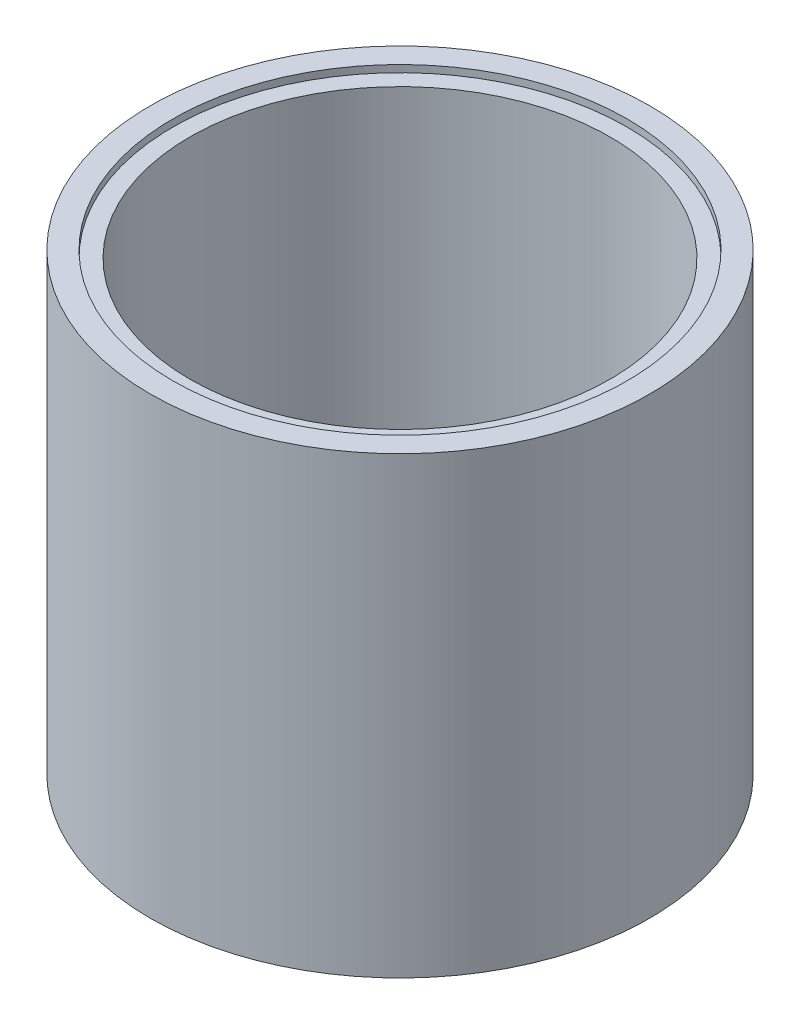
from build123d import *

# Parameters (mm, degrees)
SKETCH1_R                    = 55.88
SKETCH1_R_2                  = 46.99
BOSS_EXTRUDE4_DEPTH          = 101.6
SKETCH3_R                    = 50.8
CUT_EXTRUDE3_DEPTH           = 1.5875
F_1_4_28_TAPPED_HOLE1_REACH  = 156.393
F_1_4_28_TAPPED_HOLE1_BORE_R = 2.7051


with BuildPart() as part:
    # Sketch1 → Boss-Extrude4 (new body)
    with BuildSketch(Plane(origin=(0, 0, 0), x_dir=(1, 0, 0), z_dir=(0, 1, 0))):
        with Locations(Location((0, 0, 0), (0, 0, 270))):
            Circle(SKETCH1_R)
        with Locations(Location((0, 0, 0), (0, 0, 270))):
            Circle(SKETCH1_R_2, mode=Mode.SUBTRACT)
    extrude(amount=-BOSS_EXTRUDE4_DEPTH)

    # Sketch3 → Cut-Extrude3 (cut)
    with BuildSketch(Plane(origin=(0, 0, 0), x_dir=(1, 0, 0), z_dir=(0, 1, 0))):
        with Locations(Location((0, 0, 0), (0, 0, 270))):
            Circle(SKETCH3_R)
    extrude(amount=-CUT_EXTRUDE3_DEPTH, mode=Mode.SUBTRACT)

    # 1/4-28 Tapped Hole1 bore (on position points) → 1/4-28 Tapped Hole1 (cut, up to next)
    with BuildSketch(Plane(origin=(-54.781474323, -84.349985228, 11.025627917), x_dir=(-0.197309017847, 0, -0.980341344368), z_dir=(-0.980341344368, 0, 0.197309017847)), mode=Mode.PRIVATE) as f_1_4_28_tapped_hole1_sk1:
        Circle(F_1_4_28_TAPPED_HOLE1_BORE_R)
    f_1_4_28_tapped_hole1_tool1 = extrude(f_1_4_28_tapped_hole1_sk1.sketch, amount=-F_1_4_28_TAPPED_HOLE1_REACH, mode=Mode.PRIVATE) & part.part
    add(f_1_4_28_tapped_hole1_tool1.solids().sort_by_distance((-54.781474, -84.349985, 11.025628))[0], mode=Mode.SUBTRACT)


solid = part.part
